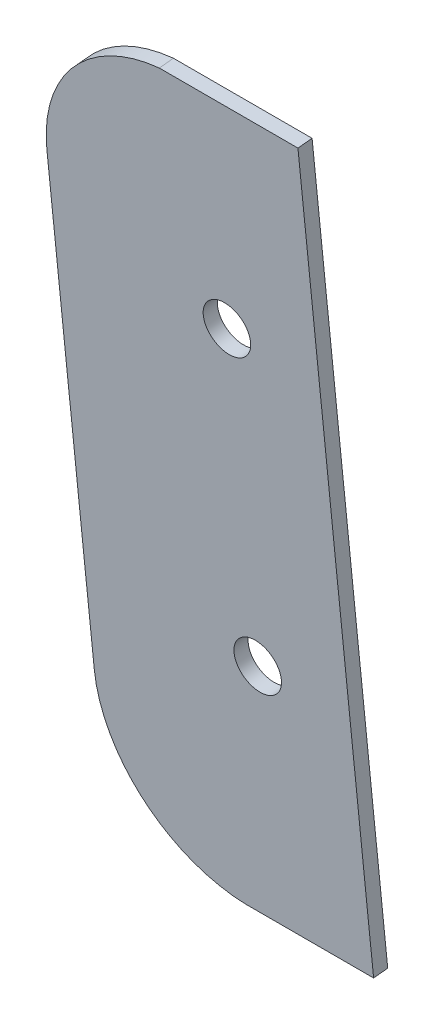
from build123d import *

# Parameters (mm, degrees)
BOSS_EXTRUDE2_DEPTH = 1.5
SKETCH2_RX          = 2.512468905
SKETCH2_RY          = 2.5
CUT_EXTRUDE1_DEPTH  = 82.304057571


with BuildPart() as part:
    # Sketch1 → Boss-Extrude2 (new body)
    with BuildSketch(Plane(origin=(0, 7.782968327, -77.829683267), x_dir=(1, 0, 0), z_dir=(0, -0.09950371902099842, 0.9950371902099893))):
        with BuildLine():
            Line((-22.056639236, -7.811403035), (-8.5, -7.811403035))
            Line((-8.5, -7.811403035), (-8.5, 72.486835274))
            Line((-8.5, 72.486835274), (-23.140108221, 72.486835274))
            add(Edge.make_bspline(
                [(-23.140108221, 72.486835274), (-33.185752444, 71.376302341), (-35.93451502, 61.602554427)],
                knots=[3.25115225, 3.25115225, 3.25115225, 4.436931985, 4.436931985, 4.436931985], degree=2, weights=[1, 0.829329402, 1]))
            add(Edge.make_bspline(
                [(-35.93451502, 61.602554427), (-36.5, 59.591865073), (-36.5, 57.502405173)],
                knots=[1.295339331, 1.295339331, 1.295339331, 1.570796327, 1.570796327, 1.570796327], degree=2, weights=[1, 0.990530414, 1]))
            Line((-36.5, 57.502405173), (-36.5, 7.253027067))
            add(Edge.make_bspline(
                [(-36.5, 7.253027067), (-36.5, -7.272375759), (-22.056639236, -7.811403035)],
                knots=[4.71238898, 4.71238898, 4.71238898, 6.246067502, 6.246067502, 6.246067502], degree=2, weights=[1, 0.720107382, 1]))
        make_face()
    extrude(amount=BOSS_EXTRUDE2_DEPTH)

    # Sketch2 → Cut-Extrude1 (cut, through all)
    with BuildSketch(Plane(origin=(0, 7.782968327, -77.829683267), x_dir=(-1, 0, 0), z_dir=(0, 0.0995037190209984, -0.9950371902099893))):
        with Locations(Location((18.25, 17.194242647), (0, 0, 90))):
            Ellipse(SKETCH2_RX, SKETCH2_RY)
        with Locations(Location((18.25, 49.856338415), (0, 0, 90))):
            Ellipse(SKETCH2_RX, SKETCH2_RY)
    extrude(amount=-CUT_EXTRUDE1_DEPTH, mode=Mode.SUBTRACT)


solid = part.part
